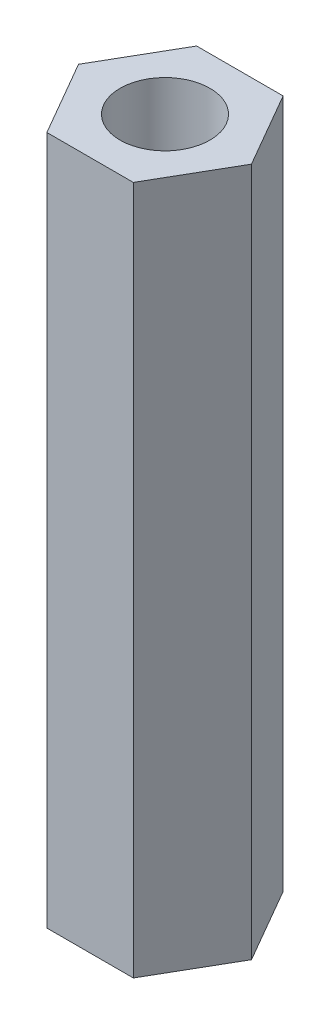
from build123d import *

# Parameters (mm, degrees)
ESQUISSE1_R      = 1.5
EXTRUSION1_DEPTH = 23


with BuildPart() as part:
    # Esquisse1 → Extrusion1 (new body)
    with BuildSketch(Plane(origin=(0, 0, 0), x_dir=(1, 0, 0), z_dir=(0, 1, 0))):
        Polygon((2.886751346, 0), (1.443375673, 2.5), (-1.443375673, 2.5), (-2.886751346, 0), (-1.443375673, -2.5), (1.443375673, -2.5), align=None)
        with Locations(Location((0, 0, 0), (0, 0, 270))):
            Circle(ESQUISSE1_R, mode=Mode.SUBTRACT)
    extrude(amount=EXTRUSION1_DEPTH)


solid = part.part
